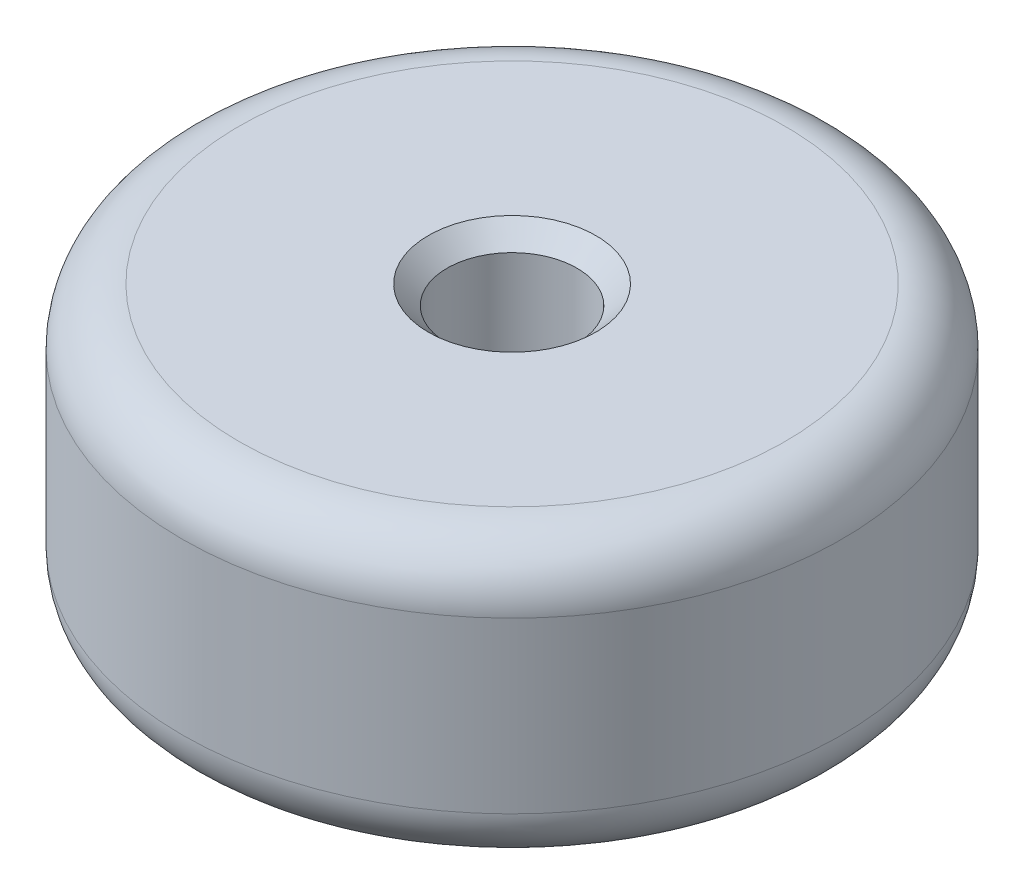
from build123d import *

# Parameters (mm, degrees)
SKETCH2_R               = 17.5
BOSS_EXTRUDE1_DEPTH     = 7.5
FILLET1_R               = 3
CUT_EXTRUDE1_DEPTH      = 26.860201082
CUT_EXTRUDE1_DEPTH_BACK = 26.860201082
SKETCH4_R               = 3.448
CHAMFER1_SIZE           = 1


with BuildPart() as part:
    # Sketch2 → Boss-Extrude1 (new, symmetric)
    with BuildSketch(Plane(origin=(0, 0, 0), x_dir=(1, 0, 0), z_dir=(0, 1, 0))):
        Circle(SKETCH2_R)
    extrude(amount=BOSS_EXTRUDE1_DEPTH, both=True)

    # Fillet1
    fillet1_edges = [part.edges().sort_by_distance(p)[0] for p in [
        (-17.5, -7.5, 0),
        (-17.5, 7.5, 0),
    ]]
    fillet(fillet1_edges, radius=FILLET1_R)

    # Sketch4 → Cut-Extrude1 (cut, two sides: drawn at the far end of the back side and taken through both)
    with BuildSketch(Plane(origin=(0, 0, 0), x_dir=(1, 0, 0), z_dir=(0, 1, 0)).offset(-CUT_EXTRUDE1_DEPTH_BACK)):
        Circle(SKETCH4_R)
    extrude(amount=CUT_EXTRUDE1_DEPTH + CUT_EXTRUDE1_DEPTH_BACK, mode=Mode.SUBTRACT)

    # Chamfer1
    chamfer1_edges = [part.edges().sort_by_distance(p)[0] for p in [
        (-3.448, 7.5, 0),
        (-3.448, -7.5, 0),
    ]]
    chamfer(chamfer1_edges, length=CHAMFER1_SIZE)


solid = part.part
